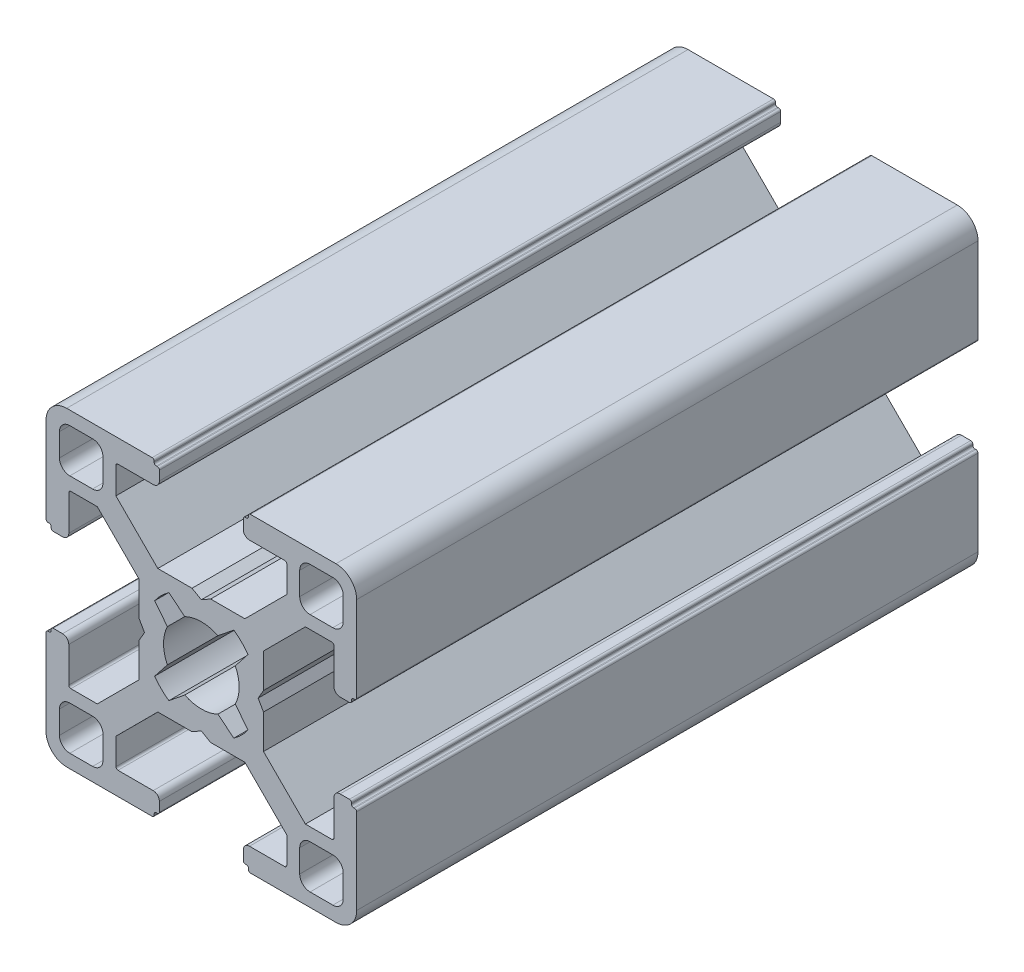
from build123d import *

# Parameters (mm, degrees)
BASE_EXTRUDE_DEPTH = 60


with BuildPart() as part:
    # Sketch1 → Base-Extrude (new body)
    with BuildSketch(Plane.XY):
        with BuildLine():
            Line((6.00446543, 0.899999619), (5.484852164, 0))
            Line((5.484852164, 0), (6.00446543, -0.899999619))
            Line((6.00446543, -0.899999619), (6.00446543, -4.204465866))
            Line((6.00446543, -4.204465866), (10.049999564, -8.25))
            Line((10.049999564, -8.25), (12.59999928, -8.25))
            ThreePointArc((12.59999928, -8.25), (12.741420837, -8.191421273), (12.799999564, -8.049999716))
            Line((12.799999564, -8.049999716), (12.799999564, -4.649999613))
            ThreePointArc((12.799999564, -4.649999613), (12.975735606, -4.225735278), (13.39999994, -4.049999237))
            Line((13.39999994, -4.049999237), (14.300000043, -4.049999237))
            ThreePointArc((14.300000043, -4.049999237), (14.4414216, -4.108577964), (14.500000327, -4.249999521))
            Line((14.500000327, -4.249999521), (14.500000327, -4.349998953))
            ThreePointArc((14.500000327, -4.349998953), (14.558579054, -4.49142051), (14.700000611, -4.549999237))
            Line((14.700000611, -4.549999237), (14.799999716, -4.549999237))
            ThreePointArc((14.799999716, -4.549999237), (14.941421273, -4.608577964), (15, -4.749999521))
            Line((15, -4.749999521), (15, -13.000000346))
            ThreePointArc((15, -13.000000346), (14.414213664, -14.414213664), (13.000000346, -15))
            Line((13.000000346, -15), (4.749999945, -15))
            ThreePointArc((4.749999945, -15), (4.60857832, -14.941421245), (4.549999564, -14.799999619))
            Line((4.549999564, -14.799999619), (4.549999564, -14.69999942))
            ThreePointArc((4.549999564, -14.69999942), (4.49142109, -14.558578474), (4.350000144, -14.5))
            Line((4.350000144, -14.5), (4.250000374, -14.5))
            ThreePointArc((4.250000374, -14.5), (4.108578753, -14.441421247), (4.05, -14.299999626))
            Line((4.05, -14.299999626), (4.05, -13.399999434))
            ThreePointArc((4.05, -13.399999434), (4.225735989, -12.975735226), (4.650000197, -12.799999237))
            Line((4.650000197, -12.799999237), (8.049999924, -12.799999237))
            ThreePointArc((8.049999924, -12.799999237), (8.191421565, -12.741420475), (8.250000327, -12.599998834))
            Line((8.250000327, -12.599998834), (8.250000327, -10.049999237))
            Line((8.250000327, -10.049999237), (4.204466193, -6))
            Line((4.204466193, -6), (0.899999946, -6))
            Line((0.899999946, -6), (0, -5.484851837))
            Line((0, -5.484851837), (-0.899999946, -6))
            Line((-0.899999946, -6), (-4.204466193, -6))
            Line((-4.204466193, -6), (-8.250000327, -10.049999237))
            Line((-8.250000327, -10.049999237), (-8.250000327, -12.599998834))
            ThreePointArc((-8.250000327, -12.599998834), (-8.191421565, -12.741420475), (-8.049999924, -12.799999237))
            Line((-8.049999924, -12.799999237), (-4.650000197, -12.799999237))
            ThreePointArc((-4.650000197, -12.799999237), (-4.225735989, -12.975735226), (-4.05, -13.399999434))
            Line((-4.05, -13.399999434), (-4.05, -14.299999626))
            ThreePointArc((-4.05, -14.299999626), (-4.108578753, -14.441421247), (-4.250000374, -14.5))
            Line((-4.250000374, -14.5), (-4.350000144, -14.5))
            ThreePointArc((-4.350000144, -14.5), (-4.49142109, -14.558578474), (-4.549999564, -14.69999942))
            Line((-4.549999564, -14.69999942), (-4.549999564, -14.799999619))
            ThreePointArc((-4.549999564, -14.799999619), (-4.60857832, -14.941421245), (-4.749999945, -15))
            Line((-4.749999945, -15), (-13.000000346, -15))
            ThreePointArc((-13.000000346, -15), (-14.414213664, -14.414213664), (-15, -13.000000346))
            Line((-15, -13.000000346), (-15, -4.749999521))
            ThreePointArc((-15, -4.749999521), (-14.941421273, -4.608577964), (-14.799999716, -4.549999237))
            Line((-14.799999716, -4.549999237), (-14.700000611, -4.549999237))
            ThreePointArc((-14.700000611, -4.549999237), (-14.558579054, -4.49142051), (-14.500000327, -4.349998953))
            Line((-14.500000327, -4.349998953), (-14.500000327, -4.249999521))
            ThreePointArc((-14.500000327, -4.249999521), (-14.4414216, -4.108577964), (-14.300000043, -4.049999237))
            Line((-14.300000043, -4.049999237), (-13.39999994, -4.049999237))
            ThreePointArc((-13.39999994, -4.049999237), (-12.975735606, -4.225735278), (-12.799999564, -4.649999613))
            Line((-12.799999564, -4.649999613), (-12.799999564, -8.049999716))
            ThreePointArc((-12.799999564, -8.049999716), (-12.741420837, -8.191421273), (-12.59999928, -8.25))
            Line((-12.59999928, -8.25), (-10.049999564, -8.25))
            Line((-10.049999564, -8.25), (-6.00446543, -4.204465866))
            Line((-6.00446543, -4.204465866), (-6.00446543, -0.899999619))
            Line((-6.00446543, -0.899999619), (-5.484852164, 0))
            Line((-5.484852164, 0), (-6.00446543, 0.899999619))
            Line((-6.00446543, 0.899999619), (-6.00446543, 4.204465866))
            Line((-6.00446543, 4.204465866), (-10.049999564, 8.25))
            Line((-10.049999564, 8.25), (-12.59999928, 8.25))
            ThreePointArc((-12.59999928, 8.25), (-12.741420837, 8.191421273), (-12.799999564, 8.049999716))
            Line((-12.799999564, 8.049999716), (-12.799999564, 4.649999613))
            ThreePointArc((-12.799999564, 4.649999613), (-12.975735606, 4.225735278), (-13.39999994, 4.049999237))
            Line((-13.39999994, 4.049999237), (-14.300000043, 4.049999237))
            ThreePointArc((-14.300000043, 4.049999237), (-14.4414216, 4.108577964), (-14.500000327, 4.249999521))
            Line((-14.500000327, 4.249999521), (-14.500000327, 4.349998953))
            ThreePointArc((-14.500000327, 4.349998953), (-14.558579054, 4.49142051), (-14.700000611, 4.549999237))
            Line((-14.700000611, 4.549999237), (-14.799999716, 4.549999237))
            ThreePointArc((-14.799999716, 4.549999237), (-14.941421273, 4.608577964), (-15, 4.749999521))
            Line((-15, 4.749999521), (-15, 13.000000346))
            ThreePointArc((-15, 13.000000346), (-14.414213664, 14.414213664), (-13.000000346, 15))
            Line((-13.000000346, 15), (-4.749999945, 15))
            ThreePointArc((-4.749999945, 15), (-4.60857832, 14.941421245), (-4.549999564, 14.799999619))
            Line((-4.549999564, 14.799999619), (-4.549999564, 14.69999942))
            ThreePointArc((-4.549999564, 14.69999942), (-4.49142109, 14.558578474), (-4.350000144, 14.5))
            Line((-4.350000144, 14.5), (-4.250000374, 14.5))
            ThreePointArc((-4.250000374, 14.5), (-4.108578753, 14.441421247), (-4.05, 14.299999626))
            Line((-4.05, 14.299999626), (-4.05, 13.399999434))
            ThreePointArc((-4.05, 13.399999434), (-4.225735989, 12.975735226), (-4.650000197, 12.799999237))
            Line((-4.650000197, 12.799999237), (-8.049999924, 12.799999237))
            ThreePointArc((-8.049999924, 12.799999237), (-8.191421565, 12.741420475), (-8.250000327, 12.599998834))
            Line((-8.250000327, 12.599998834), (-8.250000327, 10.049999237))
            Line((-8.250000327, 10.049999237), (-4.204466193, 6))
            Line((-4.204466193, 6), (-0.899999946, 6))
            Line((-0.899999946, 6), (0, 5.484851837))
            Line((0, 5.484851837), (0.899999946, 6))
            Line((0.899999946, 6), (4.204466193, 6))
            Line((4.204466193, 6), (8.250000327, 10.049999237))
            Line((8.250000327, 10.049999237), (8.250000327, 12.599998834))
            ThreePointArc((8.250000327, 12.599998834), (8.191421565, 12.741420475), (8.049999924, 12.799999237))
            Line((8.049999924, 12.799999237), (4.650000197, 12.799999237))
            ThreePointArc((4.650000197, 12.799999237), (4.225735989, 12.975735226), (4.05, 13.399999434))
            Line((4.05, 13.399999434), (4.05, 14.299999626))
            ThreePointArc((4.05, 14.299999626), (4.108578753, 14.441421247), (4.250000374, 14.5))
            Line((4.250000374, 14.5), (4.350000144, 14.5))
            ThreePointArc((4.350000144, 14.5), (4.49142109, 14.558578474), (4.549999564, 14.69999942))
            Line((4.549999564, 14.69999942), (4.549999564, 14.799999619))
            ThreePointArc((4.549999564, 14.799999619), (4.60857832, 14.941421245), (4.749999945, 15))
            Line((4.749999945, 15), (13.000000346, 15))
            ThreePointArc((13.000000346, 15), (14.414213664, 14.414213664), (15, 13.000000346))
            Line((15, 13.000000346), (15, 4.749999521))
            ThreePointArc((15, 4.749999521), (14.941421273, 4.608577964), (14.799999716, 4.549999237))
            Line((14.799999716, 4.549999237), (14.700000611, 4.549999237))
            ThreePointArc((14.700000611, 4.549999237), (14.558579054, 4.49142051), (14.500000327, 4.349998953))
            Line((14.500000327, 4.349998953), (14.500000327, 4.249999521))
            ThreePointArc((14.500000327, 4.249999521), (14.4414216, 4.108577964), (14.300000043, 4.049999237))
            Line((14.300000043, 4.049999237), (13.39999994, 4.049999237))
            ThreePointArc((13.39999994, 4.049999237), (12.975735606, 4.225735278), (12.799999564, 4.649999613))
            Line((12.799999564, 4.649999613), (12.799999564, 8.049999716))
            ThreePointArc((12.799999564, 8.049999716), (12.741420837, 8.191421273), (12.59999928, 8.25))
            Line((12.59999928, 8.25), (10.049999564, 8.25))
            Line((10.049999564, 8.25), (6.00446543, 4.204465866))
            Line((6.00446543, 4.204465866), (6.00446543, 0.899999619))
        make_face()
        with BuildLine():
            Line((13.70000109, 12.700000408), (13.70000109, 10.499999626))
            ThreePointArc((13.70000109, 10.499999626), (13.407107874, 9.792892851), (12.7000011, 9.499999635))
            Line((12.7000011, 9.499999635), (10.500000318, 9.499999635))
            ThreePointArc((10.500000318, 9.499999635), (9.792893543, 9.792892851), (9.500000327, 10.499999626))
            Line((9.500000327, 10.499999626), (9.500000327, 12.700000408))
            ThreePointArc((9.500000327, 12.700000408), (9.792893543, 13.407107182), (10.500000318, 13.700000398))
            Line((10.500000318, 13.700000398), (12.7000011, 13.700000398))
            ThreePointArc((12.7000011, 13.700000398), (13.407107874, 13.407107182), (13.70000109, 12.700000408))
        make_face(mode=Mode.SUBTRACT)
        with BuildLine():
            Line((3.135929412, 4.518400903), (1.600129524, 3.280561767))
            ThreePointArc((1.600129524, 3.280561767), (0, 3.65), (-1.600129524, 3.280561767))
            Line((-1.600129524, 3.280561767), (-3.135929412, 4.518400903))
            ThreePointArc((-3.135929412, 4.518400903), (-3.881002259, 3.897155561), (-4.505336892, 3.154669473))
            Line((-4.505336892, 3.154669473), (-3.280561732, 1.600129597))
            ThreePointArc((-3.280561732, 1.600129597), (-3.65, 0), (-3.280561732, -1.600129597))
            Line((-3.280561732, -1.600129597), (-4.505336892, -3.154669473))
            ThreePointArc((-4.505336892, -3.154669473), (-3.881002259, -3.897155561), (-3.135929412, -4.518400903))
            Line((-3.135929412, -4.518400903), (-1.600129524, -3.280561767))
            ThreePointArc((-1.600129524, -3.280561767), (0, -3.65), (1.600129524, -3.280561767))
            Line((1.600129524, -3.280561767), (3.135929412, -4.518400903))
            ThreePointArc((3.135929412, -4.518400903), (3.881002259, -3.897155561), (4.505336892, -3.154669473))
            Line((4.505336892, -3.154669473), (3.280561732, -1.600129597))
            ThreePointArc((3.280561732, -1.600129597), (3.65, 0), (3.280561732, 1.600129597))
            Line((3.280561732, 1.600129597), (4.505336892, 3.154669473))
            ThreePointArc((4.505336892, 3.154669473), (3.881002259, 3.897155561), (3.135929412, 4.518400903))
        make_face(mode=Mode.SUBTRACT)
        with BuildLine():
            Line((-13.70000109, -12.700000408), (-13.70000109, -10.499999626))
            ThreePointArc((-13.70000109, -10.499999626), (-13.407107874, -9.792892851), (-12.7000011, -9.499999635))
            Line((-12.7000011, -9.499999635), (-10.500000318, -9.499999635))
            ThreePointArc((-10.500000318, -9.499999635), (-9.792893543, -9.792892851), (-9.500000327, -10.499999626))
            Line((-9.500000327, -10.499999626), (-9.500000327, -12.700000408))
            ThreePointArc((-9.500000327, -12.700000408), (-9.792893543, -13.407107182), (-10.500000318, -13.700000398))
            Line((-10.500000318, -13.700000398), (-12.7000011, -13.700000398))
            ThreePointArc((-12.7000011, -13.700000398), (-13.407107874, -13.407107182), (-13.70000109, -12.700000408))
        make_face(mode=Mode.SUBTRACT)
        with BuildLine():
            Line((10.500000318, -13.700000398), (12.7000011, -13.700000398))
            ThreePointArc((12.7000011, -13.700000398), (13.407107874, -13.407107182), (13.70000109, -12.700000408))
            Line((13.70000109, -12.700000408), (13.70000109, -10.499999626))
            ThreePointArc((13.70000109, -10.499999626), (13.407107874, -9.792892851), (12.7000011, -9.499999635))
            Line((12.7000011, -9.499999635), (10.500000318, -9.499999635))
            ThreePointArc((10.500000318, -9.499999635), (9.792893543, -9.792892851), (9.500000327, -10.499999626))
            Line((9.500000327, -10.499999626), (9.500000327, -12.700000408))
            ThreePointArc((9.500000327, -12.700000408), (9.792893543, -13.407107182), (10.500000318, -13.700000398))
        make_face(mode=Mode.SUBTRACT)
        with BuildLine():
            Line((-10.500000318, 13.700000398), (-12.7000011, 13.700000398))
            ThreePointArc((-12.7000011, 13.700000398), (-13.407107874, 13.407107182), (-13.70000109, 12.700000408))
            Line((-13.70000109, 12.700000408), (-13.70000109, 10.499999626))
            ThreePointArc((-13.70000109, 10.499999626), (-13.407107874, 9.792892851), (-12.7000011, 9.499999635))
            Line((-12.7000011, 9.499999635), (-10.500000318, 9.499999635))
            ThreePointArc((-10.500000318, 9.499999635), (-9.792893543, 9.792892851), (-9.500000327, 10.499999626))
            Line((-9.500000327, 10.499999626), (-9.500000327, 12.700000408))
            ThreePointArc((-9.500000327, 12.700000408), (-9.792893543, 13.407107182), (-10.500000318, 13.700000398))
        make_face(mode=Mode.SUBTRACT)
    extrude(amount=-BASE_EXTRUDE_DEPTH)


solid = part.part
